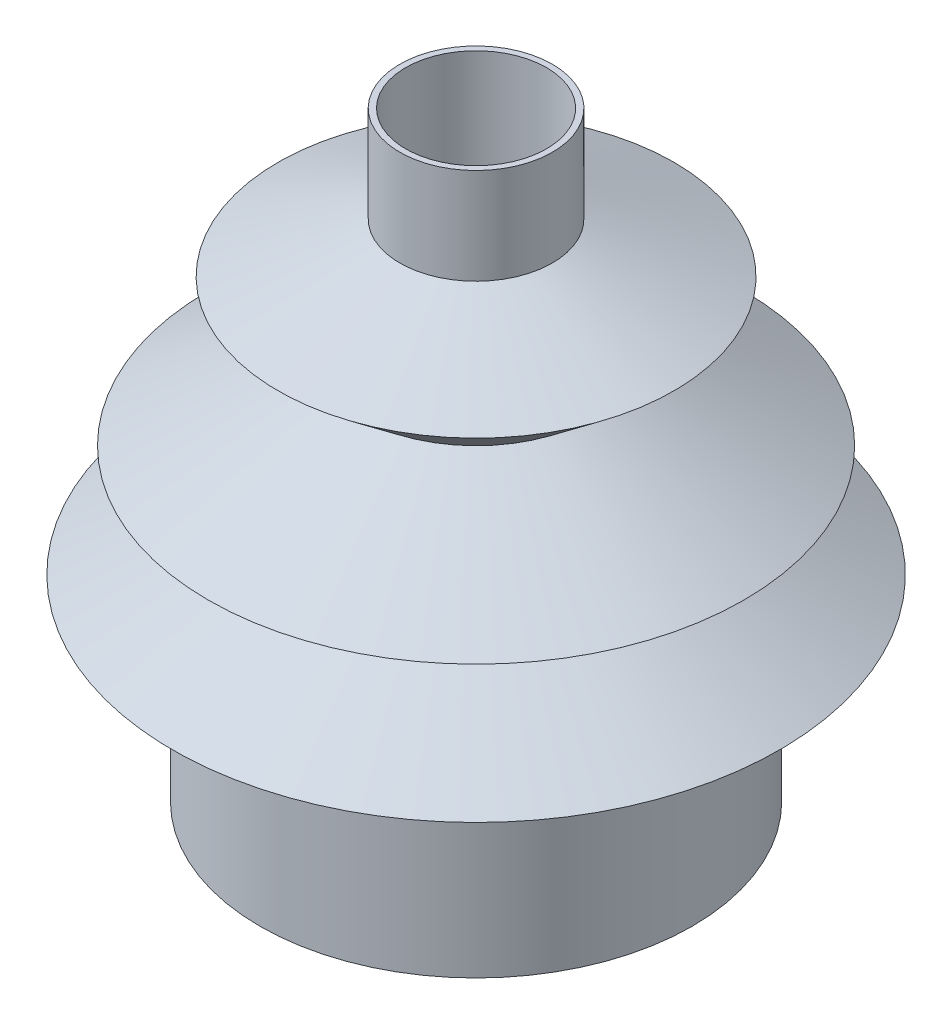
from build123d import *

# Parameters (mm, degrees)
CUT_EXTRUDE1_DEPTH      = 32.44305901
CUT_EXTRUDE1_DEPTH_BACK = 32.44305901
SKETCH2_R               = 3


with BuildPart() as part:
    # Sketch1 → Revolve1 (revolve)
    with BuildSketch(Plane.XY, mode=Mode.PRIVATE) as revolve1_sk:
        Polygon((-9.2075, 6.93899031), (-9.2075, 5.967196114), (-9.2075, 0), (-6.905893187, 0), (-6.905893187, 6.416213171), (-6.905893187, 7.390660798), (-10.285280241, 8.689390938), (-5.259867997, 11.200858424), (-8.980968211, 12.630912137), (-2.983991931, 16.129225704), (-2.983991931, 18.916244006), (-4.436960556, 19.474633476), (0, 21.979471408), (0, 25.578013153), (-3.25, 25.578013153), (-3.25, 21.491279951), (-8.434096868, 19.368086458), (-5.067424881, 16.708608808), (-11.404533468, 13.131062925), (-7.295164247, 11.551793791), (-12.931187167, 8.370038214), align=None)
    revolve(revolve1_sk.sketch.rotate(Axis((0, -7.059352361, 0), (0, 1, 0)), 270), axis=Axis((0, -7.059352361, 0), (0, 1, 0)))

    # Sketch2 → Cut-Extrude1 (cut, two sides: drawn at the far end of the back side and taken through both)
    with BuildSketch(Plane(origin=(0, 25.578013153, 0), x_dir=(1, 0, 0), z_dir=(0, 1, 0)).offset(-CUT_EXTRUDE1_DEPTH_BACK)):
        with Locations(Location((0, 0, 0), (0, 0, 90))):
            Circle(SKETCH2_R)
    extrude(amount=CUT_EXTRUDE1_DEPTH + CUT_EXTRUDE1_DEPTH_BACK, mode=Mode.SUBTRACT)


solid = part.part
